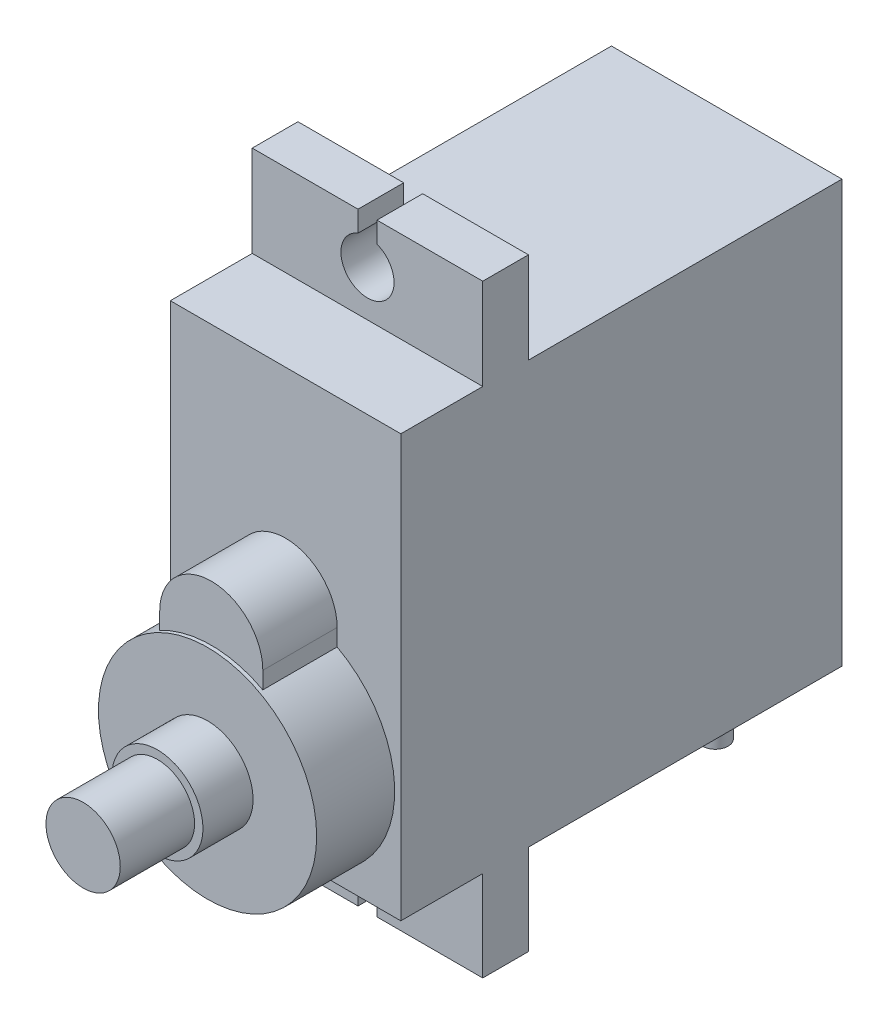
from build123d import *

# Parameters (mm, degrees)
SKETCH1_W                = 12.41
SKETCH1_H                = 23.75
BOSS_EXTRUDE1_DEPTH      = 22.71
SKETCH2_R                = 5.875
BOSS_EXTRUDE3_DEPTH      = 4.2
BOSS_EXTRUDE4_DEPTH      = 4
BOSS_EXTRUDE5_DEPTH      = 4.87
BOSS_EXTRUDE5_DEPTH_BACK = 27.62
SKETCH6_W                = 12.41
SKETCH6_H                = 2.46
SKETCH8_R                = 1.43
CUT_EXTRUDE1_DEPTH       = 36.929209565
SKETCH9_W                = 1.02
SKETCH9_H                = 2.455
CUT_EXTRUDE2_DEPTH       = 36.929209565
SKETCH10_R               = 2.45
SKETCH10_R_2             = 0.885
BOSS_EXTRUDE7_DEPTH      = 2.7
BOSS_EXTRUDE8_DEPTH      = 5
SKETCH13_R               = 2
BOSS_EXTRUDE9_DEPTH      = 4


with BuildPart() as part:
    # Sketch1 → Boss-Extrude1 (new body)
    with BuildSketch(Plane(origin=(0, 0, 0), x_dir=(1, 0, 0), z_dir=(0, 1, 0))):
        with Locations((6.205, 11.875)):
            Rectangle(SKETCH1_W, SKETCH1_H)
    extrude(amount=BOSS_EXTRUDE1_DEPTH)

    # Sketch2 → Boss-Extrude3 (add)
    with BuildSketch(Plane.XY):
        with Locations((6.205, 5.875)):
            Circle(SKETCH2_R)
    extrude(amount=BOSS_EXTRUDE3_DEPTH)

    # Sketch4 → Boss-Extrude4 (add)
    with BuildSketch(Plane.XY):
        with BuildLine():
            Line((3.43, 11.965), (3.43, 11.053320191))
            Line((3.43, 11.053320191), (8.98, 11.053320191))
            Line((8.98, 11.053320191), (8.98, 11.965))
            ThreePointArc((8.98, 11.965), (6.205, 14.74), (3.43, 11.965))
        make_face()
    extrude(amount=BOSS_EXTRUDE4_DEPTH)

    # Sketch6 → Boss-Extrude5 (add, two sides: drawn at the far end of the back side and taken through both)
    with BuildSketch(Plane.XZ.offset(-BOSS_EXTRUDE5_DEPTH_BACK)):
        with Locations((6.205, -5.64)):
            Rectangle(SKETCH6_W, SKETCH6_H)
    extrude(amount=BOSS_EXTRUDE5_DEPTH + BOSS_EXTRUDE5_DEPTH_BACK)

    # Sketch8 → Cut-Extrude1 (cut, through all)
    with BuildSketch(Plane.XY.offset(-4.41)):
        with Locations((6.205, 25.165)):
            Circle(SKETCH8_R)
        with Locations((6.205, -2.415)):
            Circle(SKETCH8_R)
    extrude(amount=-CUT_EXTRUDE1_DEPTH, mode=Mode.SUBTRACT)

    # Sketch9 → Cut-Extrude2 (cut, through all)
    with BuildSketch(Plane.XY.offset(-4.41)):
        with Locations((6.205, 26.3925)):
            Rectangle(SKETCH9_W, SKETCH9_H)
        with Locations((6.205, -3.6425)):
            Rectangle(SKETCH9_W, SKETCH9_H)
    extrude(amount=-CUT_EXTRUDE2_DEPTH, mode=Mode.SUBTRACT)

    # Sketch10 → Boss-Extrude7 (add)
    with BuildSketch(Plane.XY.offset(4.2)):
        with Locations((6.205, 5.875)):
            Circle(SKETCH10_R)
        with Locations((6.205, 5.875)):
            Circle(SKETCH10_R_2, mode=Mode.SUBTRACT)
    extrude(amount=BOSS_EXTRUDE7_DEPTH)

    # Sketch12 → Boss-Extrude8 (add)
    with BuildSketch(Plane.XZ):
        with BuildLine():
            ThreePointArc((5.61, -22.289411255), (6.205, -22.635), (6.8, -22.289411255))
            ThreePointArc((6.8, -22.289411255), (8.08, -21.95), (6.8, -21.610588745))
            ThreePointArc((6.8, -21.610588745), (6.205, -21.265), (5.61, -21.610588745))
            ThreePointArc((5.61, -21.610588745), (4.33, -21.95), (5.61, -22.289411255))
        make_face()
    extrude(amount=BOSS_EXTRUDE8_DEPTH)

    # Sketch13 → Boss-Extrude9 (add)
    with BuildSketch(Plane.XY.offset(6.9)):
        with Locations((6.205, 5.875)):
            Circle(SKETCH13_R)
    extrude(amount=BOSS_EXTRUDE9_DEPTH)


solid = part.part
